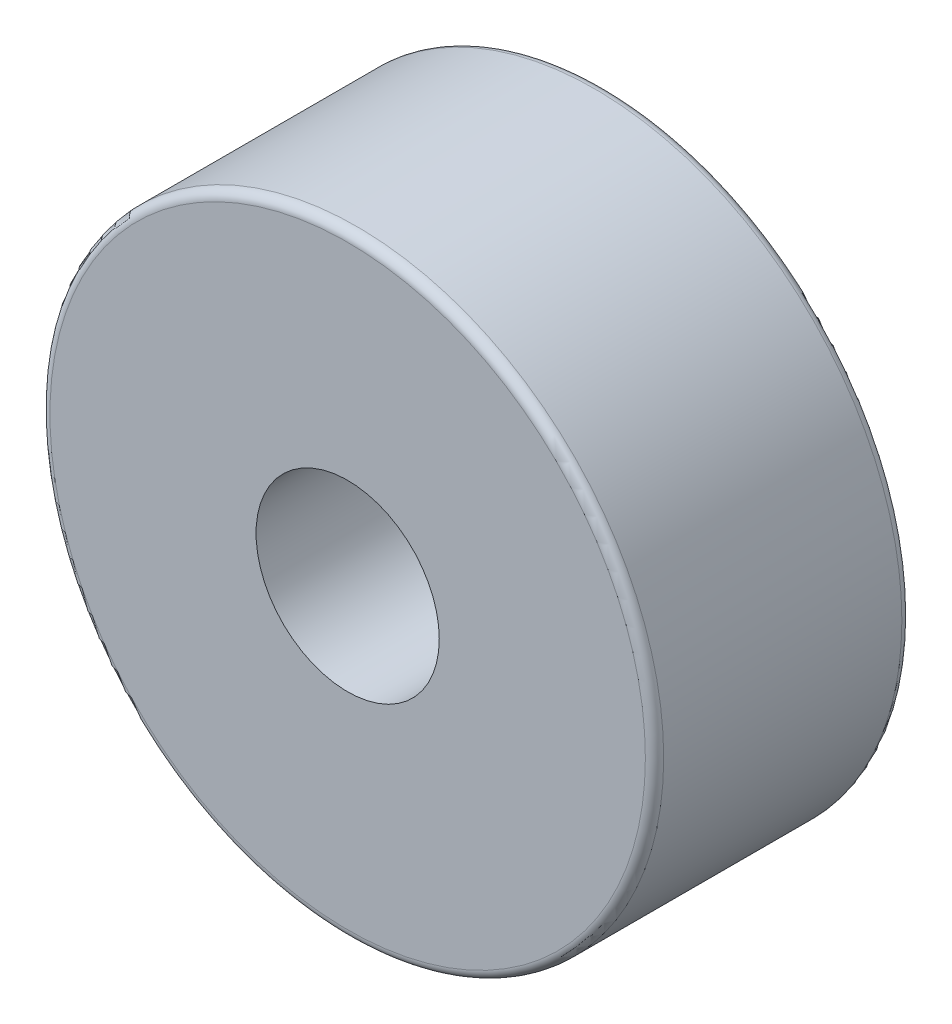
from build123d import *

# Parameters (mm, degrees)
ESQUISSE1_R        = 33.5
ESQUISSE1_R_2      = 10
BOSS_EXTRU_1_DEPTH = 28
CONG_1_R           = 1


with BuildPart() as part:
    # Esquisse1 → Boss.-Extru.1 (new body)
    with BuildSketch(Plane.XY):
        Circle(ESQUISSE1_R)
        Circle(ESQUISSE1_R_2, mode=Mode.SUBTRACT)
    extrude(amount=BOSS_EXTRU_1_DEPTH)

    # Congé1
    cong_1_edges = [part.edges().sort_by_distance(p)[0] for p in [
        (-33.5, 0, 0),
        (-33.5, 0, 28),
    ]]
    fillet(cong_1_edges, radius=CONG_1_R)


solid = part.part
